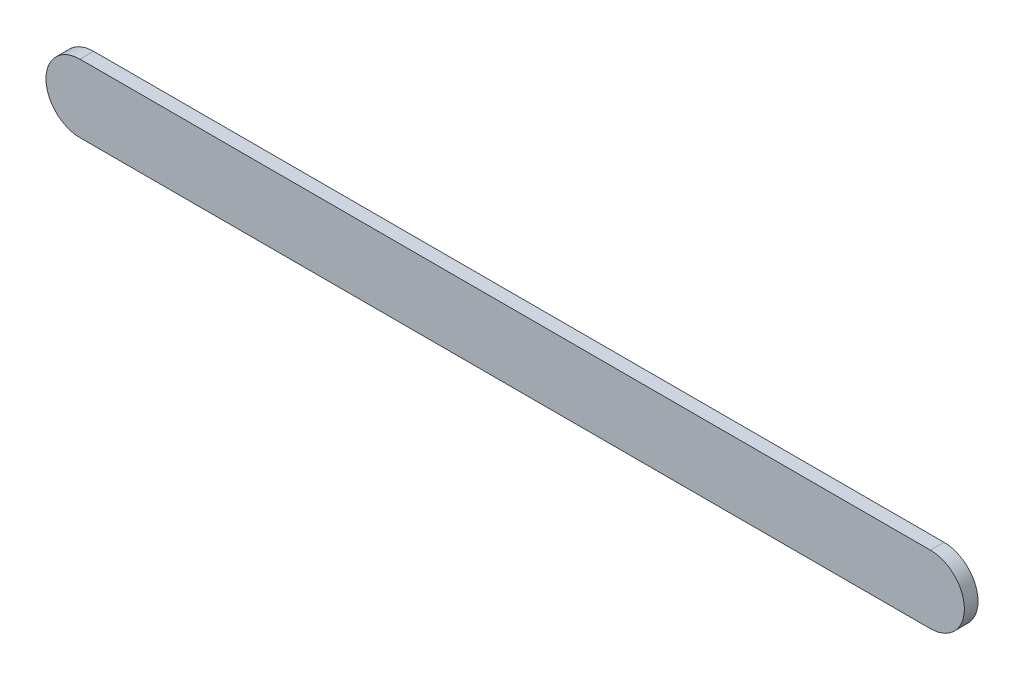
from build123d import *

# Parameters (mm, degrees)
BOSS_EXTRUDE1_DEPTH = 1


with BuildPart() as part:
    # Sketch1 → Boss-Extrude1 (new, symmetric)
    with BuildSketch(Plane.XY):
        with BuildLine():
            Line((0, 5), (125, 5))
            ThreePointArc((125, 5), (130, 0), (125, -5))
            Line((125, -5), (0, -5))
            ThreePointArc((0, -5), (-5, 0), (0, 5))
        make_face()
    extrude(amount=BOSS_EXTRUDE1_DEPTH, both=True)


solid = part.part
